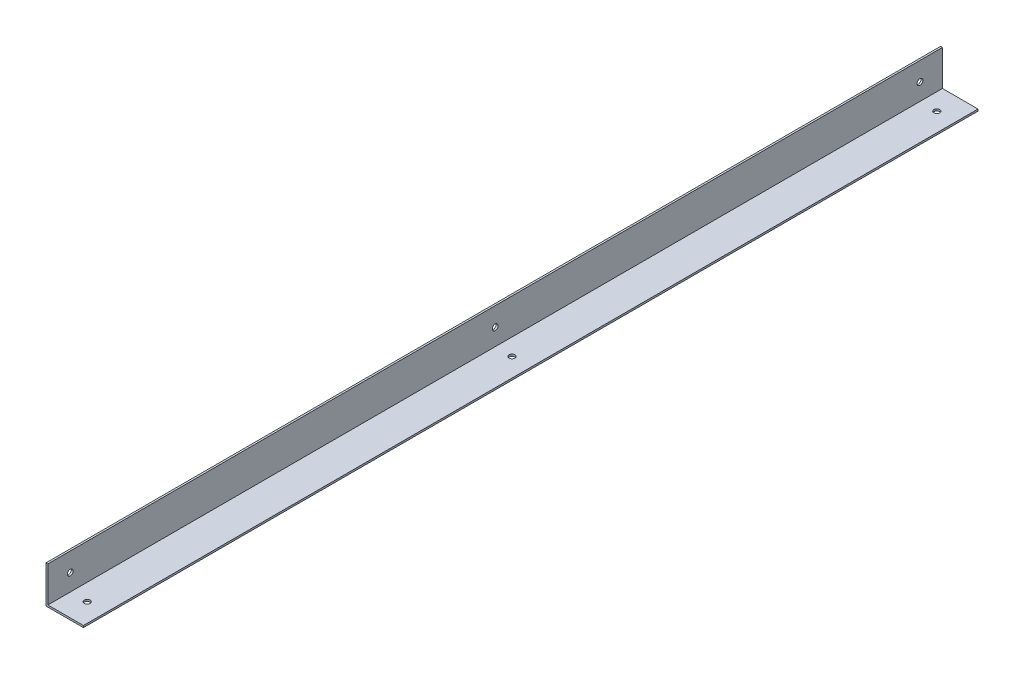
from build123d import *

# Parameters (mm, degrees)
BOSS_EXTRUDE1_DEPTH          = 758.825
F_10_0_1935_DIAMETER_HOLE1_D = 4.9149
F_10_0_1935_DIAMETER_HOLE3_D = 4.9149


with BuildPart() as part:
    # Sketch2 → Boss-Extrude1 (new body)
    with BuildSketch(Plane.XY):
        Polygon((0, 0), (0, 31.75), (1.5875, 31.75), (1.5875, 1.5875), (31.75, 1.5875), (31.75, 0), align=None)
    extrude(amount=BOSS_EXTRUDE1_DEPTH)

    # #10 (0.1935) Diameter Hole1 (through all)
    with Locations(Plane.ZY):
        with Locations((19.05, 15.875), (379.4125, 15.875), (739.775, 15.875)):
            Hole(F_10_0_1935_DIAMETER_HOLE1_D / 2)

    # #10 (0.1935) Diameter Hole3 (through all)
    with Locations(Plane(origin=(0, 0, 0), x_dir=(-1, 0, 0), z_dir=(0, -1, 0))):
        with Locations((-15.875, -739.775), (-15.875, -379.4125), (-15.875, -19.05)):
            Hole(F_10_0_1935_DIAMETER_HOLE3_D / 2)


solid = part.part
